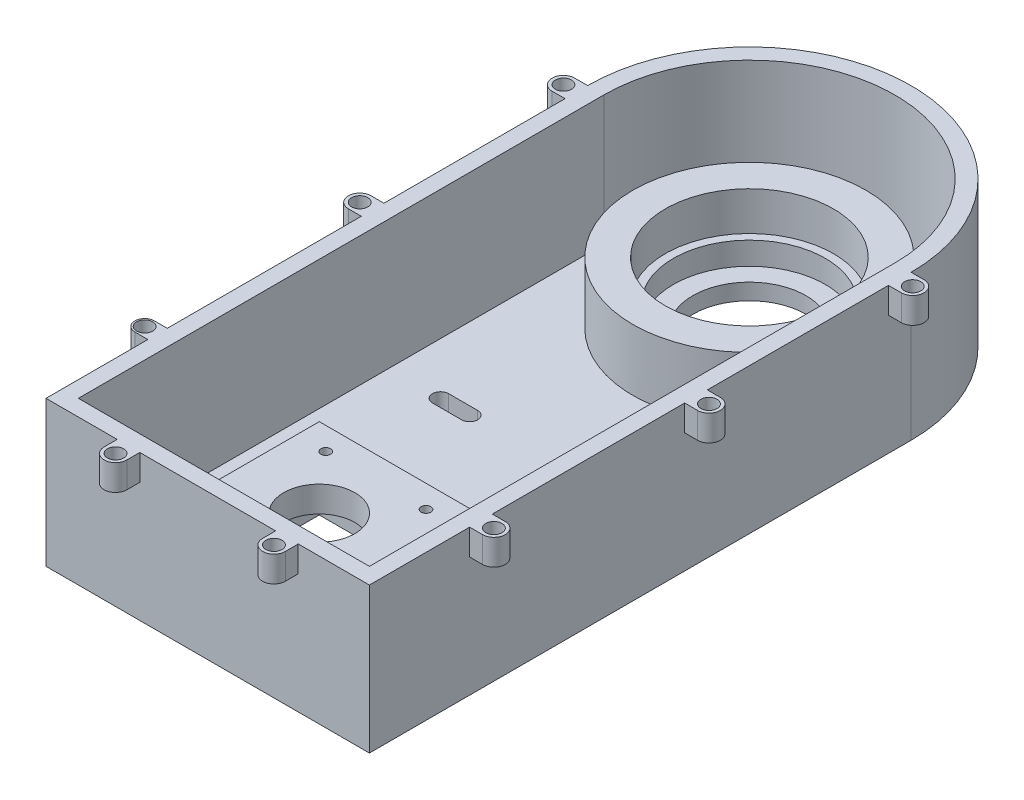
from build123d import *

# Parameters (mm, degrees)
BOSS_EXTRUDE1_DEPTH = 5
BOSS_EXTRUDE2_DEPTH = 40
SKETCH3_R           = 17.5
CUT_EXTRUDE1_DEPTH  = 40
SKETCH4_R           = 26
SKETCH4_R_2         = 23.5
BOSS_EXTRUDE3_DEPTH = 7
SKETCH5_R           = 36
SKETCH5_R_2         = 26
BOSS_EXTRUDE4_DEPTH = 19
BOSS_EXTRUDE5_DEPTH = 17
CUT_EXTRUDE2_DEPTH  = 14
SKETCH8_R           = 1.5
SKETCH8_R_2         = 11
CUT_EXTRUDE3_DEPTH  = 14
SKETCH9_R           = 2.5
CUT_EXTRUDE4_DEPTH  = 45
SKETCH10_R          = 2.5
BOSS_EXTRUDE6_DEPTH = 8


with BuildPart() as part:
    # Sketch1 → Boss-Extrude1 (new body)
    with BuildSketch(Plane(origin=(0, 0, 0), x_dir=(1, 0, 0), z_dir=(0, 1, 0))):
        with BuildLine():
            Line((50, 0), (50, -167.5))
            Line((50, -167.5), (-50, -167.5))
            Line((-50, -167.5), (-50, 0))
            ThreePointArc((-50, 0), (0, 50), (50, 0))
        make_face()
    extrude(amount=BOSS_EXTRUDE1_DEPTH)

    # Sketch2 → Boss-Extrude2 (add)
    with BuildSketch(Plane(origin=(0, 5, 0), x_dir=(1, 0, 0), z_dir=(0, 1, 0))):
        with BuildLine():
            ThreePointArc((50, 0), (0, 50), (-50, 0))
            Line((-50, 0), (-50, -167.5))
            Line((-50, -167.5), (50, -167.5))
            Line((50, -167.5), (50, 0))
        make_face()
        with BuildLine():
            Line((-45, -162.5), (-45, 0))
            ThreePointArc((-45, 0), (0, 45), (45, 0))
            Line((45, 0), (45, -162.5))
            Line((45, -162.5), (-45, -162.5))
        make_face(mode=Mode.SUBTRACT)
    extrude(amount=BOSS_EXTRUDE2_DEPTH)

    # Sketch3 → Cut-Extrude1 (cut)
    with BuildSketch(Plane(origin=(0, 5, 0), x_dir=(1, 0, 0), z_dir=(0, 1, 0))):
        with Locations(Location((0, 0, 0), (0, 0, 270))):
            Circle(SKETCH3_R)
    extrude(amount=-CUT_EXTRUDE1_DEPTH, mode=Mode.SUBTRACT)

    # Sketch4 → Boss-Extrude3 (add)
    with BuildSketch(Plane(origin=(0, 5, 0), x_dir=(1, 0, 0), z_dir=(0, 1, 0))):
        with Locations(Location((0, 0, 0), (0, 0, 90))):
            Circle(SKETCH4_R)
        with Locations(Location((0, 0, 0), (0, 0, 270))):
            Circle(SKETCH4_R_2, mode=Mode.SUBTRACT)
    extrude(amount=BOSS_EXTRUDE3_DEPTH)

    # Sketch5 → Boss-Extrude4 (add)
    with BuildSketch(Plane(origin=(0, 5, 0), x_dir=(1, 0, 0), z_dir=(0, 1, 0))):
        with Locations(Location((0, 0, 0), (0, 0, 90))):
            Circle(SKETCH5_R)
        with Locations(Location((0, 0, 0), (0, 0, 270))):
            Circle(SKETCH5_R_2, mode=Mode.SUBTRACT)
    extrude(amount=BOSS_EXTRUDE4_DEPTH)

    # Sketch6 → Boss-Extrude5 (add)
    with BuildSketch(Plane(origin=(0, 5, 0), x_dir=(1, 0, 0), z_dir=(0, 1, 0))):
        Polygon((24.5, -133), (24.5, -157.5), (-24.5, -157.5), (-24.5, -108.5), (24.5, -108.5), align=None)
    extrude(amount=BOSS_EXTRUDE5_DEPTH)

    # Sketch7 → Cut-Extrude2 (cut)
    with BuildSketch(Plane.XZ):
        Polygon((21.5, 133), (21.5, 154.5), (-21.5, 154.5), (-21.5, 111.5), (21.5, 111.5), align=None)
    extrude(amount=-CUT_EXTRUDE2_DEPTH, mode=Mode.SUBTRACT)

    # Sketch8 → Cut-Extrude3 (cut)
    with BuildSketch(Plane.XZ.offset(-14)):
        with Locations(Location((-15.5, 148.5, 0), (0, 0, 270))):
            Circle(SKETCH8_R)
        with Locations(Location((15.5, 148.5, 0), (0, 0, 270))):
            Circle(SKETCH8_R)
        with Locations(Location((-15.5, 115.5, 0), (0, 0, 270))):
            Circle(SKETCH8_R)
        with Locations(Location((15.5, 115.5, 0), (0, 0, 270))):
            Circle(SKETCH8_R)
        with Locations(Location((0, 133, 0), (0, 0, 270))):
            Circle(SKETCH8_R_2)
    extrude(amount=-CUT_EXTRUDE3_DEPTH, mode=Mode.SUBTRACT)

    # Sketch9 → Cut-Extrude4 (cut)
    with BuildSketch(Plane(origin=(0, 45, 0), x_dir=(1, 0, 0), z_dir=(0, 1, 0))):
        with BuildLine():
            ThreePointArc((-20, -69), (-22.5, -66.5), (-20, -64))
            Line((-20, -64), (-29, -64))
            ThreePointArc((-29, -64), (-31.5, -66.5), (-29, -69))
            Line((-29, -69), (-20, -69))
        make_face()
        with Locations((-20, -66.5)):
            Circle(SKETCH9_R)
        with BuildLine():
            Line((29, -64), (20, -64))
            ThreePointArc((20, -64), (21.767766953, -64.732233047), (22.5, -66.5))
            ThreePointArc((22.5, -66.5), (21.767766953, -68.267766953), (20, -69))
            Line((20, -69), (29, -69))
            ThreePointArc((29, -69), (31.5, -66.5), (29, -64))
        make_face()
        with Locations((20, -66.5)):
            Circle(SKETCH9_R)
    extrude(amount=-CUT_EXTRUDE4_DEPTH, mode=Mode.SUBTRACT)

    # Sketch10 → Boss-Extrude6 (add)
    # profile 1 of 8: a face of its own
    with BuildSketch(Plane(origin=(0, 45, 0), x_dir=(1, 0, 0), z_dir=(0, 1, 0))):
        with BuildLine():
            Line((-54, -70), (-50, -70))
            Line((-50, -70), (-50, -63))
            Line((-50, -63), (-54, -63))
            ThreePointArc((-54, -63), (-57.5, -66.5), (-54, -70))
        make_face()
        with Locations(Location((-54, -66.5, 0), (0, 0, 270))):
            Circle(SKETCH10_R, mode=Mode.SUBTRACT)
    # profile 2 of 8: a face of its own
    with BuildSketch(Plane(origin=(0, 45, 0), x_dir=(1, 0, 0), z_dir=(0, 1, 0))):
        with BuildLine():
            Line((-54, -7), (-50, -7))
            Line((-50, -7), (-50, 0))
            Line((-50, 0), (-54, 0))
            ThreePointArc((-54, 0), (-57.5, -3.5), (-54, -7))
        make_face()
        with Locations(Location((-54, -3.5, 0), (0, 0, 270))):
            Circle(SKETCH10_R, mode=Mode.SUBTRACT)
    # profile 3 of 8: a face of its own
    with BuildSketch(Plane(origin=(0, 45, 0), x_dir=(1, 0, 0), z_dir=(0, 1, 0))):
        with BuildLine():
            Line((-54, -136), (-50, -136))
            Line((-50, -136), (-50, -130))
            Line((-50, -130), (-54, -130))
            ThreePointArc((-54, -130), (-57, -133), (-54, -136))
        make_face()
        with Locations(Location((-54, -133, 0), (0, 0, 270))):
            Circle(SKETCH10_R, mode=Mode.SUBTRACT)
    # profile 4 of 8: a face of its own
    with BuildSketch(Plane(origin=(0, 45, 0), x_dir=(1, 0, 0), z_dir=(0, 1, 0))):
        with BuildLine():
            Line((28, -171.5), (28, -167.5))
            Line((28, -167.5), (21, -167.5))
            Line((21, -167.5), (21, -171.5))
            ThreePointArc((21, -171.5), (24.5, -175), (28, -171.5))
        make_face()
        with Locations(Location((24.5, -171.5, 0), (0, 0, 270))):
            Circle(SKETCH10_R, mode=Mode.SUBTRACT)
    # profile 5 of 8: a face of its own
    with BuildSketch(Plane(origin=(0, 45, 0), x_dir=(1, 0, 0), z_dir=(0, 1, 0))):
        with BuildLine():
            Line((-21, -171.5), (-21, -167.5))
            Line((-21, -167.5), (-28, -167.5))
            Line((-28, -167.5), (-28, -171.5))
            ThreePointArc((-28, -171.5), (-24.5, -175), (-21, -171.5))
        make_face()
        with Locations(Location((-24.5, -171.5, 0), (0, 0, 270))):
            Circle(SKETCH10_R, mode=Mode.SUBTRACT)
    # profile 6 of 8: a face of its own
    with BuildSketch(Plane(origin=(0, 45, 0), x_dir=(1, 0, 0), z_dir=(0, 1, 0))):
        with BuildLine():
            Line((54, -129.5), (50, -129.5))
            Line((50, -129.5), (50, -136.5))
            Line((50, -136.5), (54, -136.5))
            ThreePointArc((54, -136.5), (57.5, -133), (54, -129.5))
        make_face()
        with Locations(Location((54, -133, 0), (0, 0, 270))):
            Circle(SKETCH10_R, mode=Mode.SUBTRACT)
    # profile 7 of 8: a face of its own
    with BuildSketch(Plane(origin=(0, 45, 0), x_dir=(1, 0, 0), z_dir=(0, 1, 0))):
        with BuildLine():
            Line((54, -63), (50, -63))
            Line((50, -63), (50, -70))
            Line((50, -70), (54, -70))
            ThreePointArc((54, -70), (57.5, -66.5), (54, -63))
        make_face()
        with Locations(Location((54, -66.5, 0), (0, 0, 270))):
            Circle(SKETCH10_R, mode=Mode.SUBTRACT)
    # profile 8 of 8: a face of its own
    with BuildSketch(Plane(origin=(0, 45, 0), x_dir=(1, 0, 0), z_dir=(0, 1, 0))):
        with BuildLine():
            Line((54, 0), (50, 0))
            Line((50, 0), (50, -7))
            Line((50, -7), (54, -7))
            ThreePointArc((54, -7), (57.5, -3.5), (54, 0))
        make_face()
        with Locations(Location((54, -3.5, 0), (0, 0, 270))):
            Circle(SKETCH10_R, mode=Mode.SUBTRACT)
    extrude(amount=-BOSS_EXTRUDE6_DEPTH)


solid = part.part
